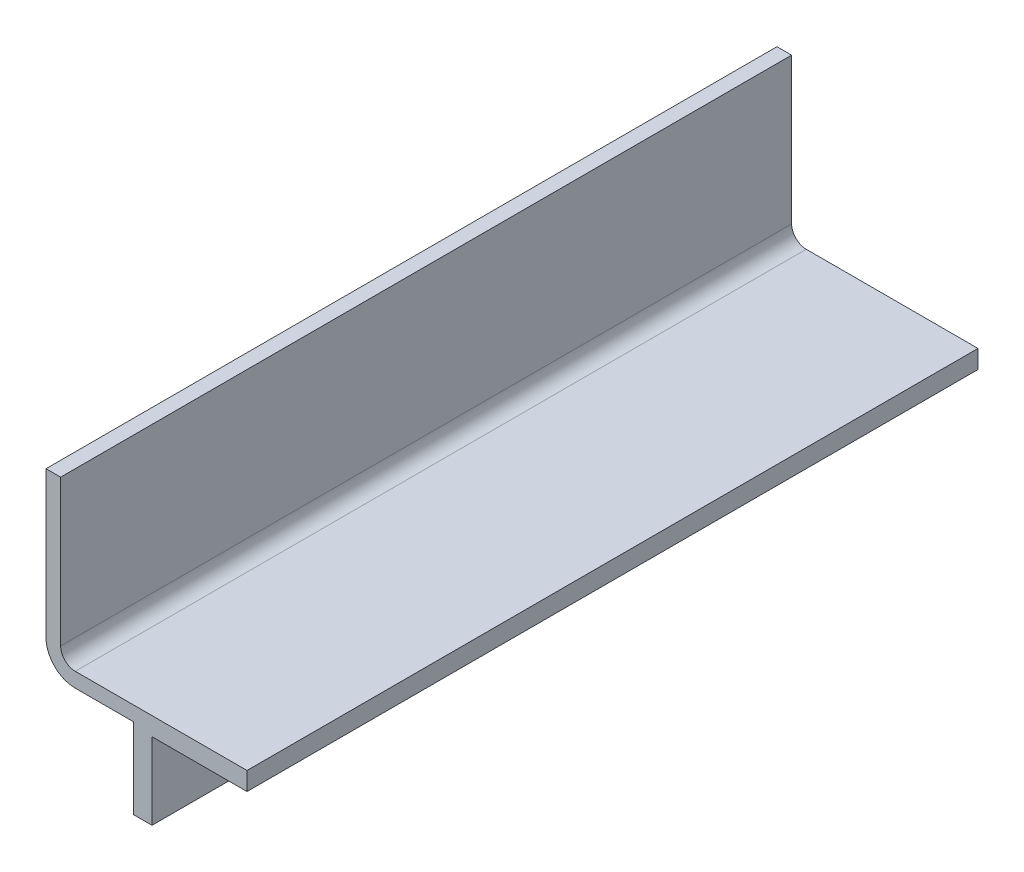
from build123d import *

# Parameters (mm, degrees)
ESTRUSIONE_ESTRUSIONE1_DEPTH = 100
FORO_PER_VITE_M4_1_D         = 4.5
FORO_PER_VITE_M4_1_DEPTH     = 30
FORO_PER_VITE_M4_1_TIP       = 1.351936393


with BuildPart() as part:
    # Schizzo1 → Estrusione-Estrusione1 (new body)
    with BuildSketch(Plane.XY):
        with BuildLine():
            Line((-2.5, 0), (0, 0))
            Line((0, 0), (0, 10.5))
            Line((0, 10.5), (13, 10.5))
            Line((13, 10.5), (13, 13))
            Line((13, 13), (-10.5, 13))
            ThreePointArc((-10.5, 13), (-11.914213562, 13.585786438), (-12.5, 15))
            Line((-12.5, 15), (-12.5, 35))
            Line((-12.5, 35), (-14.5, 35))
            Line((-14.5, 35), (-14.5, 15))
            ThreePointArc((-14.5, 15), (-13.328427125, 12.171572875), (-10.5, 11))
            Line((-10.5, 11), (-2.5, 11))
            Line((-2.5, 11), (-2.5, 0))
        make_face()
    extrude(amount=ESTRUSIONE_ESTRUSIONE1_DEPTH)

    # Foro per Vite M4-1
    with Locations(Plane.ZY.offset(2.5)):
        with Locations((15, 4.5), (85, 4.5)):
            Hole(FORO_PER_VITE_M4_1_D / 2, depth=FORO_PER_VITE_M4_1_DEPTH)
            with Locations((0, 0, -(FORO_PER_VITE_M4_1_DEPTH + FORO_PER_VITE_M4_1_TIP / 2))):  # 118° drill point
                Cone(0, FORO_PER_VITE_M4_1_D / 2, FORO_PER_VITE_M4_1_TIP, mode=Mode.SUBTRACT)


solid = part.part
